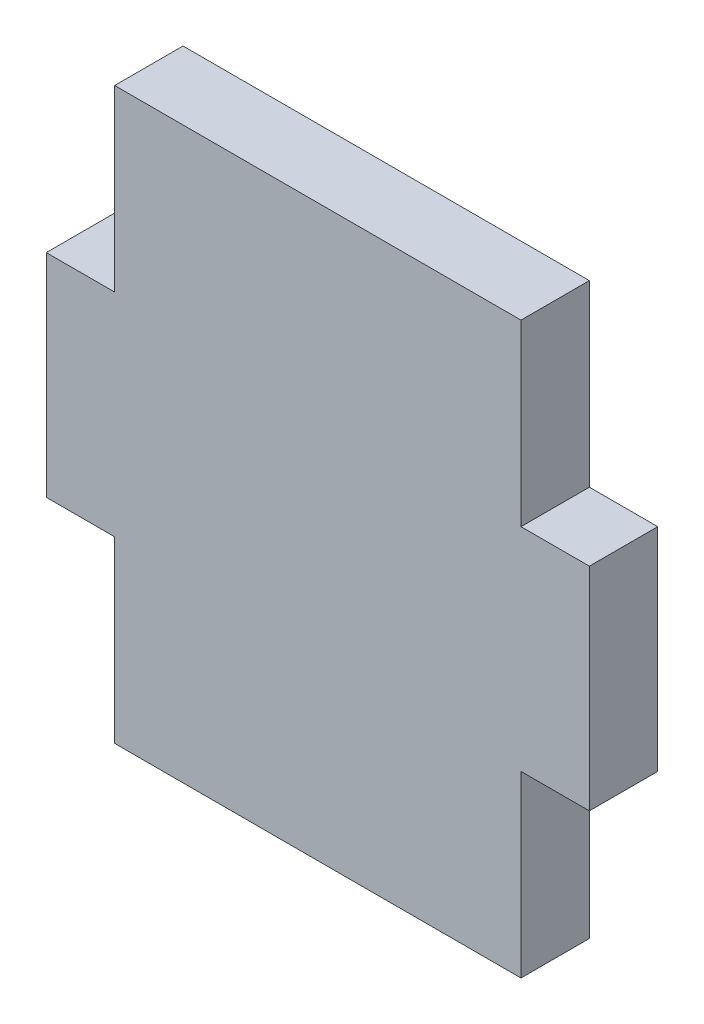
from build123d import *

# Parameters (mm, degrees)
BOSS_EXTRUDE1_DEPTH = 1.524


with BuildPart() as part:
    # Sketch1 → Boss-Extrude1 (new body)
    with BuildSketch(Plane.XY):
        Polygon((0, -14.224), (0, -10.2362), (-1.524, -10.2362), (-1.524, -5.5118), (0, -5.5118), (0, -1.524), (9.057166935, -1.524), (9.057166935, -5.5118), (10.581166935, -5.5118), (10.581166935, -10.2362), (9.057166935, -10.2362), (9.057166935, -14.224), align=None)
    extrude(amount=BOSS_EXTRUDE1_DEPTH)


solid = part.part
